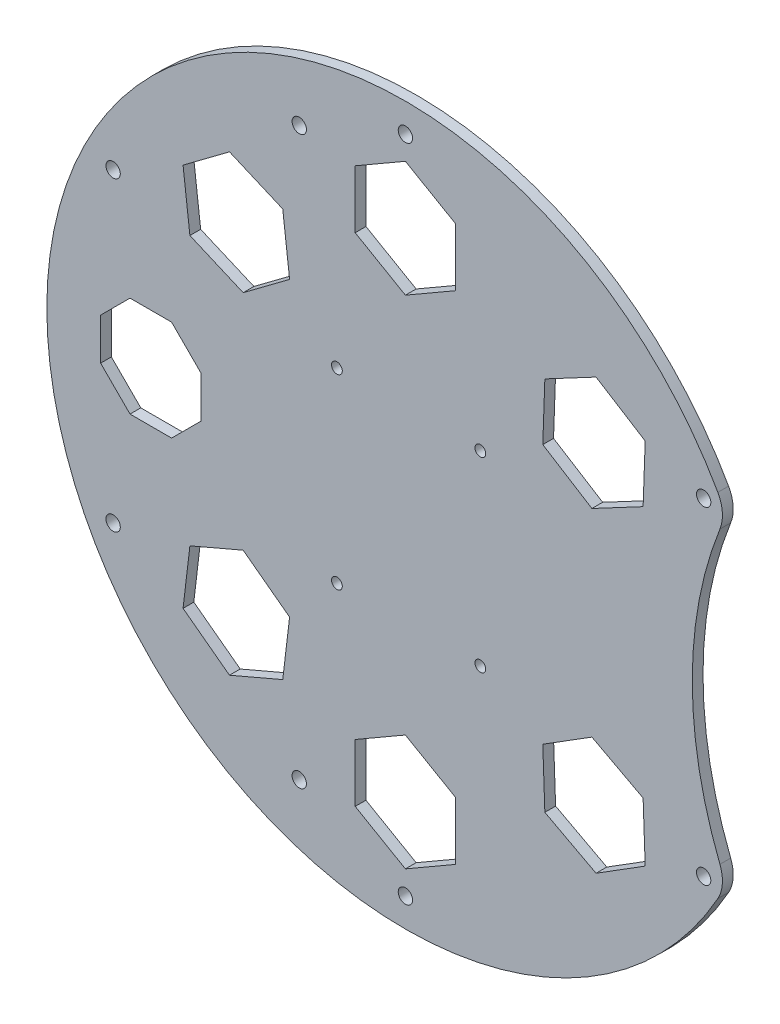
from build123d import *

# Parameters (mm, degrees)
CROQUIS1_R              = 100
SALIENTE_EXTRUIR1_DEPTH = 3
CROQUIS3_R              = 110
CORTAR_EXTRUIR1_DEPTH   = 3
REDONDEO1_R             = 10
CROQUIS4_R              = 1.5
CORTAR_EXTRUIR2_DEPTH   = 10
CORTAR_EXTRUIR3_DEPTH   = 10
CROQUIS6_R              = 2
CORTAR_EXTRUIR4_DEPTH   = 142.453172607


with BuildPart() as part:
    # Croquis1 → Saliente-Extruir1 (new body)
    with BuildSketch(Plane.XY):
        Circle(CROQUIS1_R)
    extrude(amount=SALIENTE_EXTRUIR1_DEPTH)

    # Croquis3 → Cortar-Extruir1 (cut)
    with BuildSketch(Plane.XY.offset(3)):
        with Locations((190, 0)):
            Circle(CROQUIS3_R)
    extrude(amount=-CORTAR_EXTRUIR1_DEPTH, mode=Mode.SUBTRACT)

    # Redondeo1
    redondeo1_edges = [part.edges().sort_by_distance(p)[0] for p in [
        (89.473684211, -44.659375654, 1.5),
        (89.473684211, 44.659375654, 1.5),
    ]]
    fillet(redondeo1_edges, radius=REDONDEO1_R)

    # Croquis4 → Cortar-Extruir2 (cut)
    with BuildSketch(Plane.XY.offset(3)):
        with Locations((-19.1, -26)):
            Circle(CROQUIS4_R)
        with Locations((20.9, -26)):
            Circle(CROQUIS4_R)
        with Locations((20.9, 26)):
            Circle(CROQUIS4_R)
        with Locations((-19.1, 26)):
            Circle(CROQUIS4_R)
    extrude(amount=-CORTAR_EXTRUIR2_DEPTH, mode=Mode.SUBTRACT)

    # Croquis5 → Cortar-Extruir3 (cut)
    with BuildSketch(Plane.XY.offset(3)):
        Polygon((66.297522474, -35.184824102), (66.874281495, -51.340339642), (53.171574136, -59.917585376), (38.892107757, -52.339315569), (38.315348736, -36.183800029), (52.018056095, -27.606554296), align=None)
        Polygon((14, 61.199128534), (14, 77.364936071), (0, 85.44783984), (-14, 77.364936071), (-14, 61.199128534), (0, 53.116224765), align=None)
        Polygon((-34.205975888, 56.833392886), (-49.063072127, 63.205207751), (-62.009773788, 53.524492414), (-60.099379209, 37.471962211), (-45.24228297, 31.100147347), (-32.295581309, 40.780862684), align=None)
        Polygon((66.874281495, 51.340339642), (53.171574136, 59.917585376), (38.892107757, 52.339315569), (38.315348736, 36.183800029), (52.018056095, 27.606554296), (66.297522474, 35.184824102), align=None)
        Polygon((-57, 5.798989873), (-65.201010127, 14), (-76.798989873, 14), (-85, 5.798989873), (-85, -5.798989873), (-76.798989873, -14), (-65.201010127, -14), (-57, -5.798989873), align=None)
        Polygon((0, -53.116224765), (14, -61.199128534), (14, -77.364936071), (0, -85.44783984), (-14, -77.364936071), (-14, -61.199128534), align=None)
        Polygon((-32.295581309, -40.780862684), (-34.205975888, -56.833392886), (-49.063072127, -63.205207751), (-62.009773788, -53.524492414), (-60.099379209, -37.471962211), (-45.24228297, -31.100147347), align=None)
    extrude(amount=-CORTAR_EXTRUIR3_DEPTH, mode=Mode.SUBTRACT)

    # Croquis6 → Cortar-Extruir4 (cut, through all)
    with BuildSketch(Plane.XY.offset(3)):
        with Locations((0, 92)):
            Circle(CROQUIS6_R)
        with Locations((83.182013697, 45.66031863)):
            Circle(CROQUIS6_R)
        with Locations((83.182013697, -45.66031863)):
            Circle(CROQUIS6_R)
        with Locations((0, -92)):
            Circle(CROQUIS6_R)
        with Locations((-81.512332571, -42.658406426)):
            Circle(CROQUIS6_R)
        with Locations((-81.512332571, 42.658406426)):
            Circle(CROQUIS6_R)
        with Locations((-29.6, -78.7)):
            Circle(CROQUIS6_R)
        with Locations((-29.6, 79.3)):
            Circle(CROQUIS6_R)
    extrude(amount=-CORTAR_EXTRUIR4_DEPTH, mode=Mode.SUBTRACT)


solid = part.part
